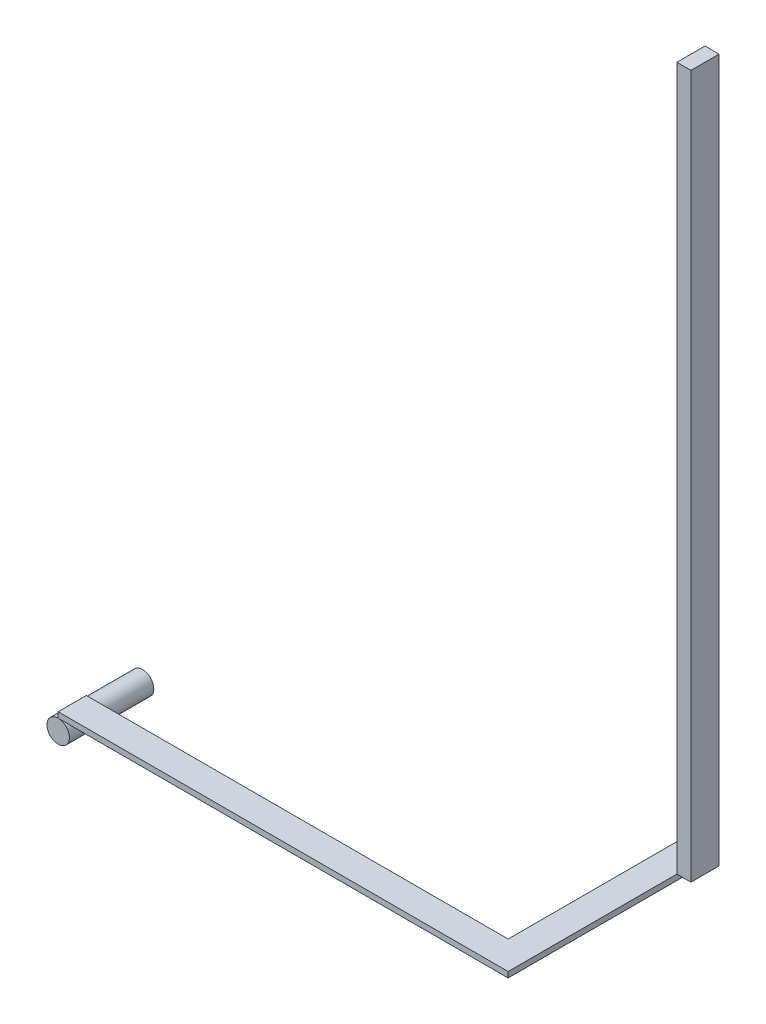
from build123d import *

# Parameters (mm, degrees)
SKETCH1_R           = 4
BOSS_EXTRUDE1_DEPTH = 30
SKETCH2_W           = 160
SKETCH2_H           = 2
BOSS_EXTRUDE2_DEPTH = 10
SKETCH3_W           = 10
SKETCH3_H           = 2
BOSS_EXTRUDE3_DEPTH = 60
SKETCH5_W           = 10
SKETCH5_H           = 250
BOSS_EXTRUDE5_DEPTH = 5


with BuildPart() as part:
    # Sketch1 → Boss-Extrude1 (new body)
    with BuildSketch(Plane.XY):
        Circle(SKETCH1_R)
    extrude(amount=BOSS_EXTRUDE1_DEPTH)


with BuildPart() as body_2:
    # Sketch2 → Boss-Extrude2 (new body)
    with BuildSketch(Plane.XY.offset(30)):
        with Locations((80, 5)):
            Rectangle(SKETCH2_W, SKETCH2_H)
    extrude(amount=-BOSS_EXTRUDE2_DEPTH)

    # Sketch3 → Boss-Extrude3 (add)
    with BuildSketch(Plane(origin=(0, 0, 20), x_dir=(-1, 0, 0), z_dir=(0, 0, -1))):
        with Locations((-155, 5)):
            Rectangle(SKETCH3_W, SKETCH3_H)
    extrude(amount=BOSS_EXTRUDE3_DEPTH)


with BuildPart() as body_3:
    # Sketch5 → Boss-Extrude5 (new body)
    with BuildSketch(Plane(origin=(160, 0, 0), x_dir=(0, 0, -1), z_dir=(1, 0, 0))):
        with Locations((35, 131)):
            Rectangle(SKETCH5_W, SKETCH5_H)
    extrude(amount=BOSS_EXTRUDE5_DEPTH)


solid = Compound([part.part, body_2.part, body_3.part])
